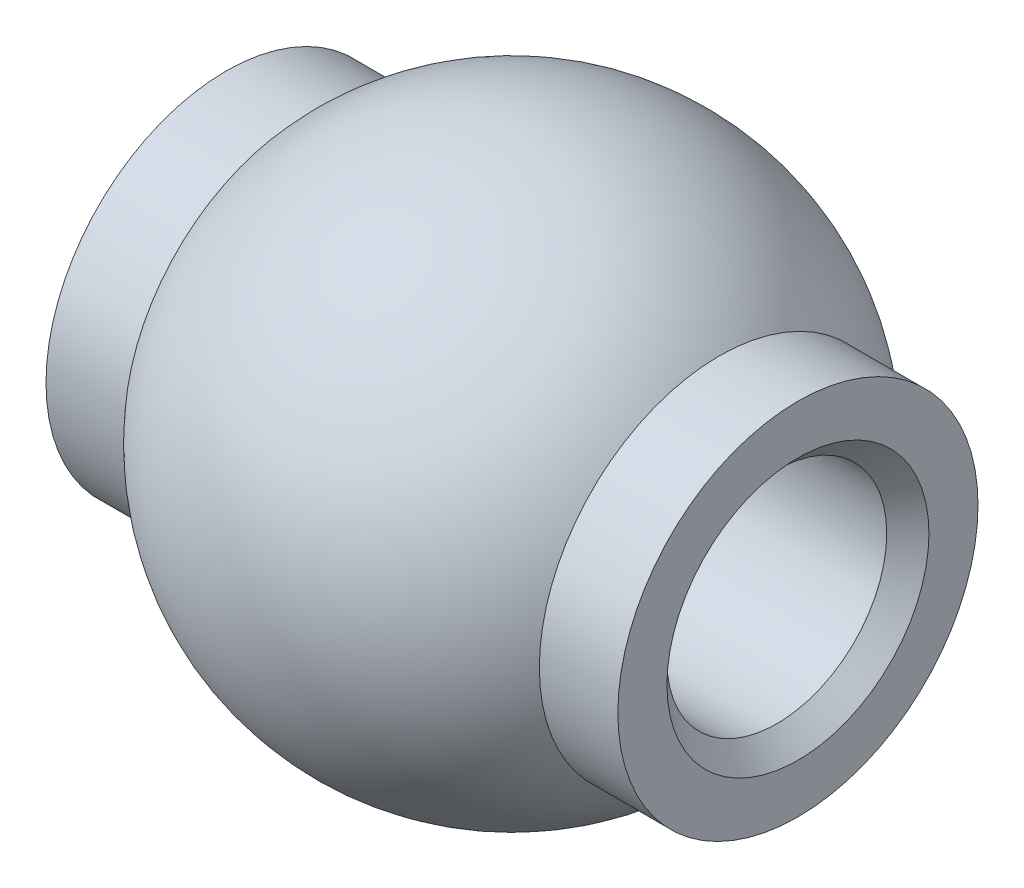
from build123d import *


with BuildPart() as part:
    # Sketch1 → Revolve1 (revolve)
    with BuildSketch(Plane.XY, mode=Mode.PRIVATE) as revolve1_sk:
        with BuildLine():
            Line((-10.3251, 6.5024), (-10.3251, 4.73075))
            Line((-10.3251, 4.73075), (-9.5631, 3.96875))
            Line((-9.5631, 3.96875), (9.5631, 3.96875))
            Line((9.5631, 3.96875), (10.3251, 4.73075))
            Line((10.3251, 4.73075), (10.3251, 6.5024))
            Line((10.3251, 6.5024), (7.489953533, 6.5024))
            ThreePointArc((7.489953533, 6.5024), (0, 9.9187), (-7.489953533, 6.5024))
            Line((-7.489953533, 6.5024), (-10.3251, 6.5024))
        make_face()
    revolve(revolve1_sk.sketch.rotate(Axis((-18.157637283, 0, 0), (1, 0, 0)), 90), axis=Axis((-18.157637283, 0, 0), (1, 0, 0)))


solid = part.part
